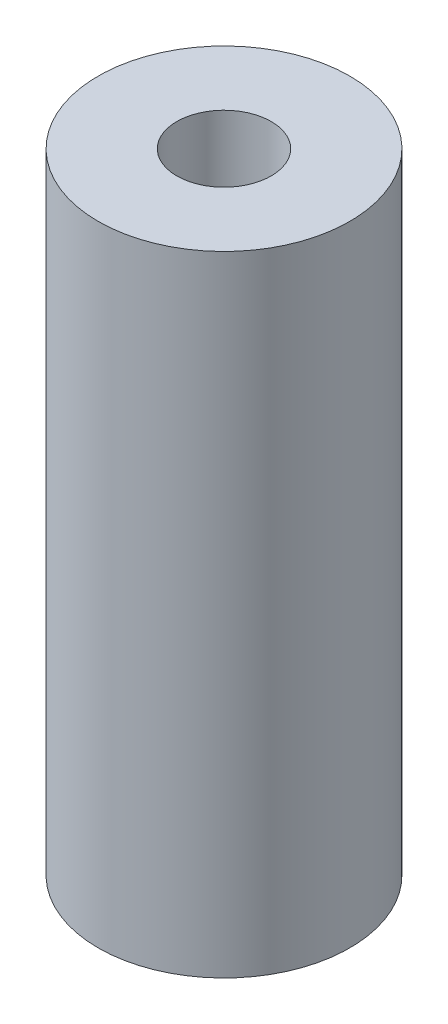
from build123d import *

# Parameters (mm, degrees)
ESQUISSE1_R        = 2
ESQUISSE1_R_2      = 0.75
BOSS_EXTRU_1_DEPTH = 10


with BuildPart() as part:
    # Esquisse1 → Boss.-Extru.1 (new body)
    with BuildSketch(Plane(origin=(0, 0, 0), x_dir=(1, 0, 0), z_dir=(0, 1, 0))):
        with Locations(Location((0, 0, 0), (0, 0, 270))):
            Circle(ESQUISSE1_R)
        with Locations(Location((0, 0, 0), (0, 0, 270))):
            Circle(ESQUISSE1_R_2, mode=Mode.SUBTRACT)
    extrude(amount=BOSS_EXTRU_1_DEPTH)


solid = part.part
